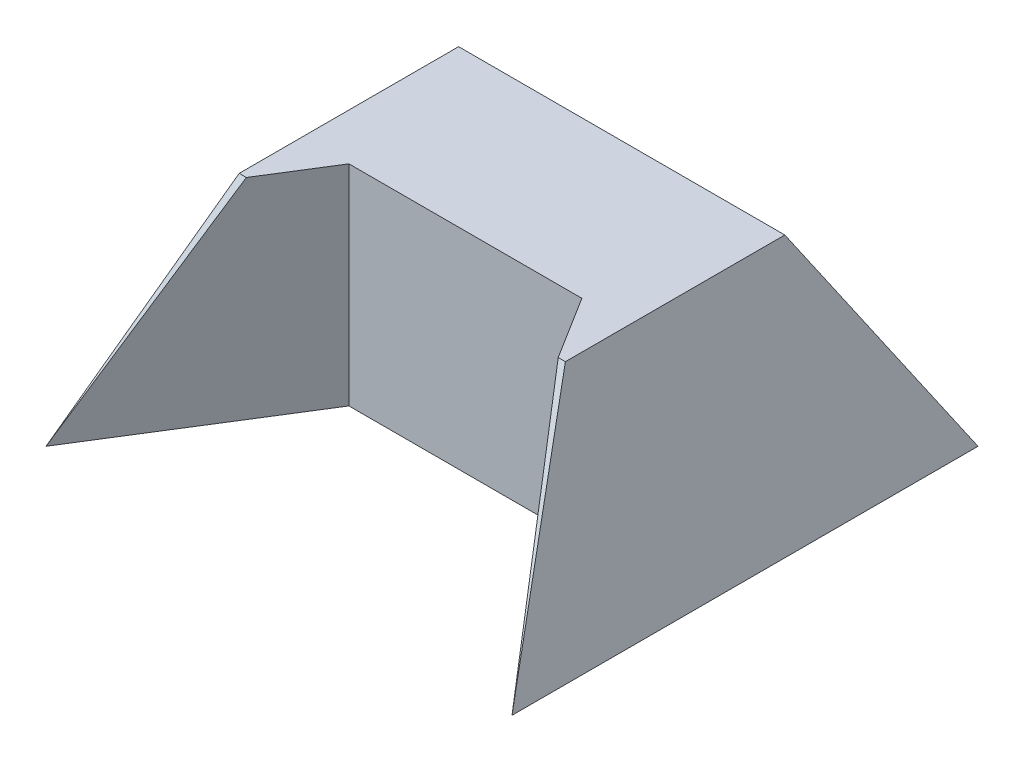
from build123d import *

# Parameters (mm, degrees)
GRUNDK_RPER_DEPTH               = 100
SCHRAEGEN_VORNE_DEPTH           = 100
SCHNITT_LINEAR_AUSTRAGEN4_DEPTH = 45


with BuildPart() as part:
    # Skizze1 → Grundkörper (new body)
    with BuildSketch(Plane.XY):
        Polygon((0, 0), (100, 0), (85, 45), (15, 45), align=None)
    extrude(amount=-GRUNDK_RPER_DEPTH)

    # Skizze2 → Schraegen_vorne (cut)
    with BuildSketch(Plane(origin=(0, 0, 0), x_dir=(0, 0, -1), z_dir=(1, 0, 0))):
        Polygon((100, 0), (73.544212344, 45), (100, 45), align=None)
    schraegen_vorne = extrude(amount=SCHRAEGEN_VORNE_DEPTH, mode=Mode.SUBTRACT)

    # Spiegel_Schraege_hinten: Schraegen_vorne across plane
    add(schraegen_vorne.mirror(Plane.XY.offset(-50)), mode=Mode.SUBTRACT)

    # Skizze4 → Schnitt-Linear austragen4 (cut)
    with BuildSketch(Plane.XZ):
        Polygon((100, 0), (75, -40), (25, -40), (0, 0), align=None)
    extrude(amount=-SCHNITT_LINEAR_AUSTRAGEN4_DEPTH, mode=Mode.SUBTRACT)


solid = part.part
